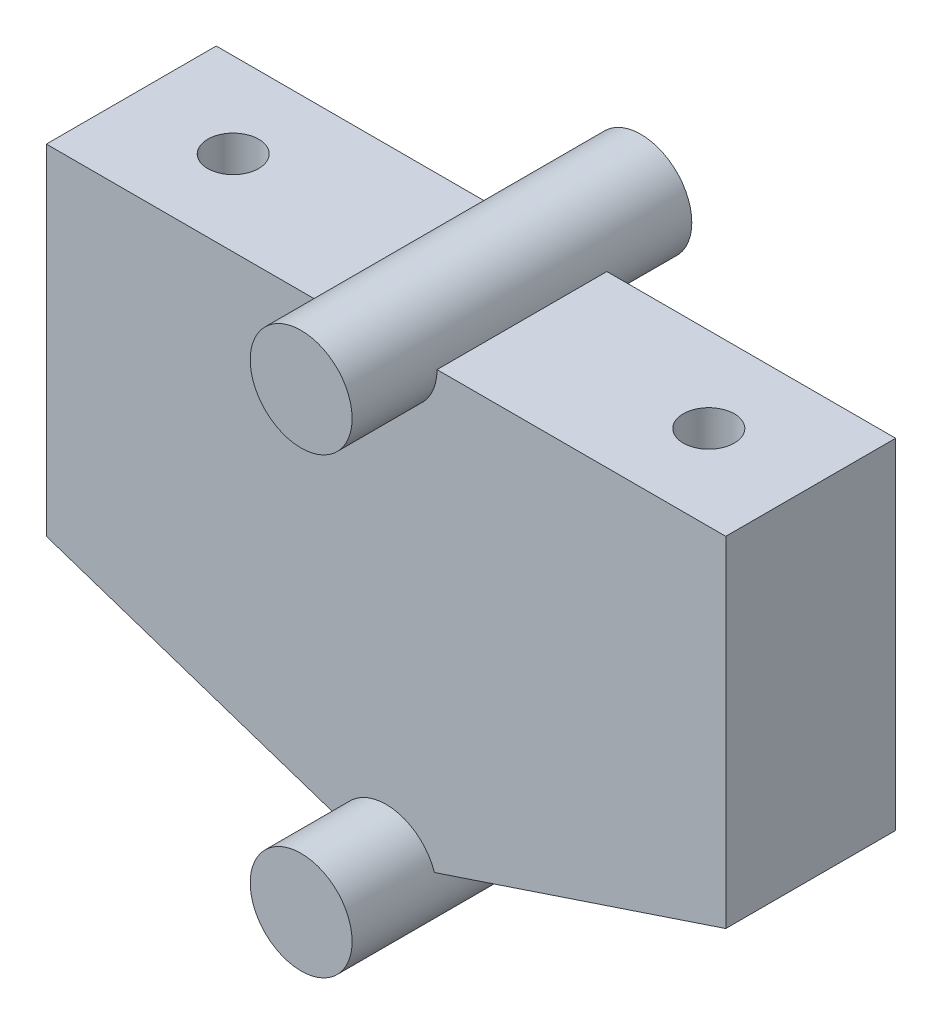
from build123d import *

# Parameters (mm, degrees)
BOSS_EXTRUDE1_DEPTH      = 10
BOSS_EXTRUDE2_DEPTH      = 15
BOSS_EXTRUDE2_DEPTH_BACK = 5
SKETCH2_R                = 1.5
CUT_EXTRUDE1_DEPTH       = 39.79576151
BOSS_EXTRUDE3_DEPTH      = 5
BOSS_EXTRUDE3_DEPTH_BACK = 15
SKETCH3_R                = 3


with BuildPart() as part:
    # Sketch1 → Boss-Extrude1 (new body)
    with BuildSketch(Plane.XY):
        with BuildLine():
            Line((-20, 10), (-20, -10))
            Line((-20, -10), (-2.846049894, -15.717983369))
            ThreePointArc((-2.846049894, -15.717983369), (0, -13.666666667), (2.846049894, -15.717983369))
            Line((2.846049894, -15.717983369), (20, -10))
            Line((20, -10), (20, 10))
            Line((20, 10), (-20, 10))
        make_face()
    extrude(amount=BOSS_EXTRUDE1_DEPTH)

    # Sketch1<3> → Boss-Extrude2 (add, two sides: drawn at the far end of the back side and taken through both)
    with BuildSketch(Plane.XY.offset(-BOSS_EXTRUDE2_DEPTH_BACK)):
        with BuildLine():
            ThreePointArc((2.846049894, -15.717983369), (0, -13.666666667), (-2.846049894, -15.717983369))
            ThreePointArc((-2.846049894, -15.717983369), (-0.480546729, -19.62792904), (3, -16.666666667))
            ThreePointArc((3, -16.666666667), (2.961262373, -16.186119938), (2.846049894, -15.717983369))
        make_face()
    extrude(amount=BOSS_EXTRUDE2_DEPTH + BOSS_EXTRUDE2_DEPTH_BACK)

    # Sketch2 → Cut-Extrude1 (cut, through all)
    with BuildSketch(Plane(origin=(0, 10, 0), x_dir=(1, 0, 0), z_dir=(0, 1, 0))):
        with Locations((-14, -5)):
            Circle(SKETCH2_R)
        with Locations((14, -5)):
            Circle(SKETCH2_R)
    extrude(amount=-CUT_EXTRUDE1_DEPTH, mode=Mode.SUBTRACT)

    # Sketch3 → Boss-Extrude3 (add, two sides: drawn at the far end of the back side and taken through both)
    with BuildSketch(Plane.XY.offset(10).offset(-BOSS_EXTRUDE3_DEPTH_BACK)):
        with Locations((0, 10)):
            Circle(SKETCH3_R)
    extrude(amount=BOSS_EXTRUDE3_DEPTH + BOSS_EXTRUDE3_DEPTH_BACK)


solid = part.part
